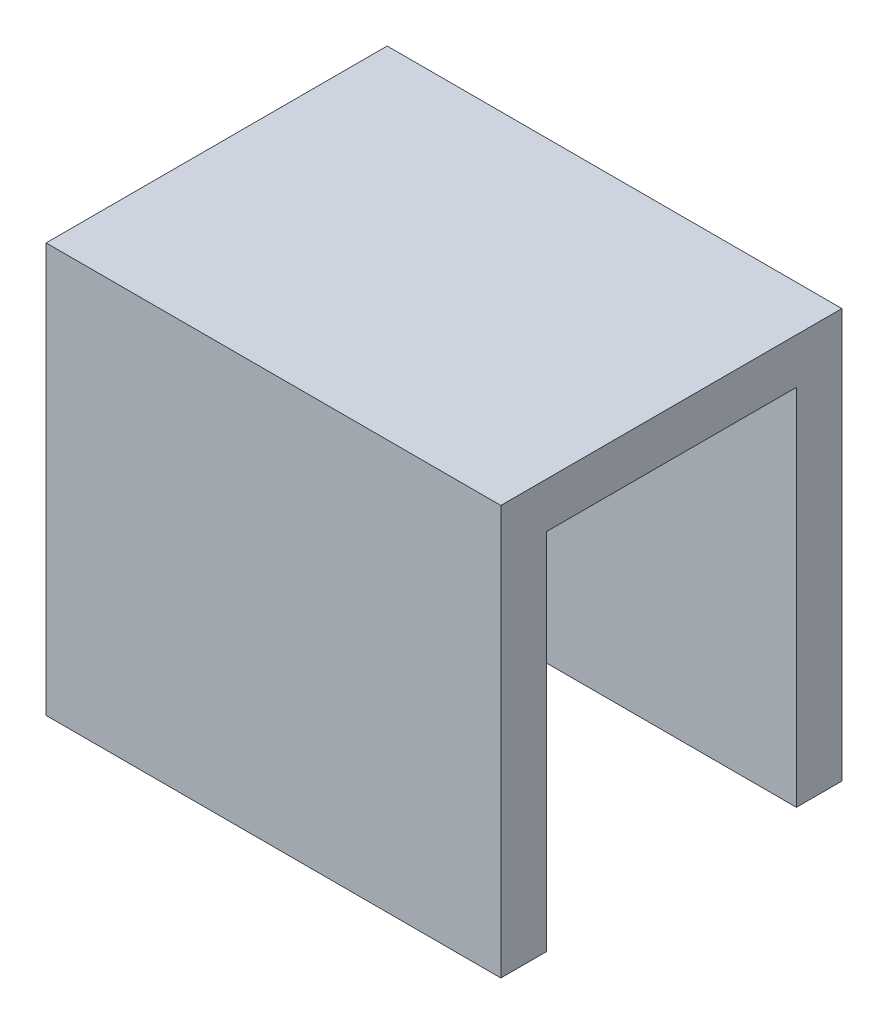
from build123d import *

# Parameters (mm, degrees)
BOSS_EXTRUDE1_DEPTH = 20


with BuildPart() as part:
    # Sketch1 → Boss-Extrude1 (new body)
    with BuildSketch(Plane(origin=(0, 0, 0), x_dir=(0, 0, -1), z_dir=(1, 0, 0))):
        Polygon((-6.711864407, 0), (-6.711864407, 18), (8.288135593, 18), (8.288135593, 0), (6.288135593, 0), (6.288135593, 16), (-4.711864407, 16), (-4.711864407, 0), align=None)
    extrude(amount=BOSS_EXTRUDE1_DEPTH)


solid = part.part
